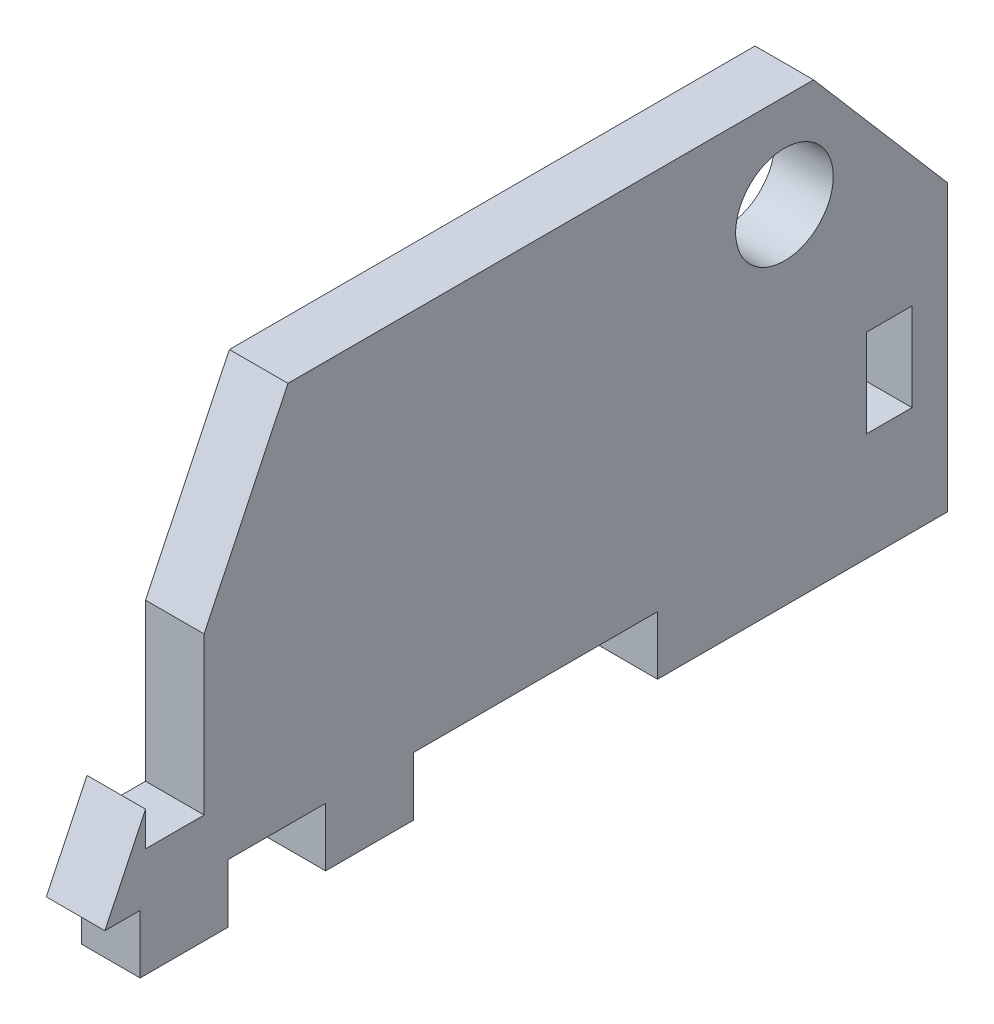
from build123d import *

# Parameters (mm, degrees)
SKETCH1_W           = 4.681910348
SKETCH1_H           = 9.021241889
SKETCH1_R           = 5
BOSS_EXTRUDE1_DEPTH = 6


with BuildPart() as part:
    # Sketch1 → Boss-Extrude1 (new body)
    with BuildSketch(Plane(origin=(0, 0, 0), x_dir=(0, 0, -1), z_dir=(1, 0, 0))):
        Polygon((-49.613790305, -26.17980707), (-53.776961548, -34.881370998), (-50.167110133, -34.881370998), (-50.167110133, -40.881370998), (-41.167110133, -40.881370998), (-41.167110133, -34.881370998), (-31.167110133, -34.881370998), (-31.167110133, -40.881370998), (-22.167110133, -40.881370998), (-22.167110133, -34.881370998), (2.832889867, -34.881370998), (2.832889867, -40.881370998), (32.552897546, -40.881370998), (32.552897546, -11.700957806), (18.820856333, 4.303972987), (-35.029148102, 4.303972987), (-43.613790305, -13.639034538), (-43.613790305, -29.701183485), (-49.613790305, -29.701183485), align=None)
        with Locations((26.557768442, -25.304755476)):
            Rectangle(SKETCH1_W, SKETCH1_H, mode=Mode.SUBTRACT)
        with Locations((15.832889867, -5.263895329)):
            Circle(SKETCH1_R, mode=Mode.SUBTRACT)
    extrude(amount=BOSS_EXTRUDE1_DEPTH)


solid = part.part
